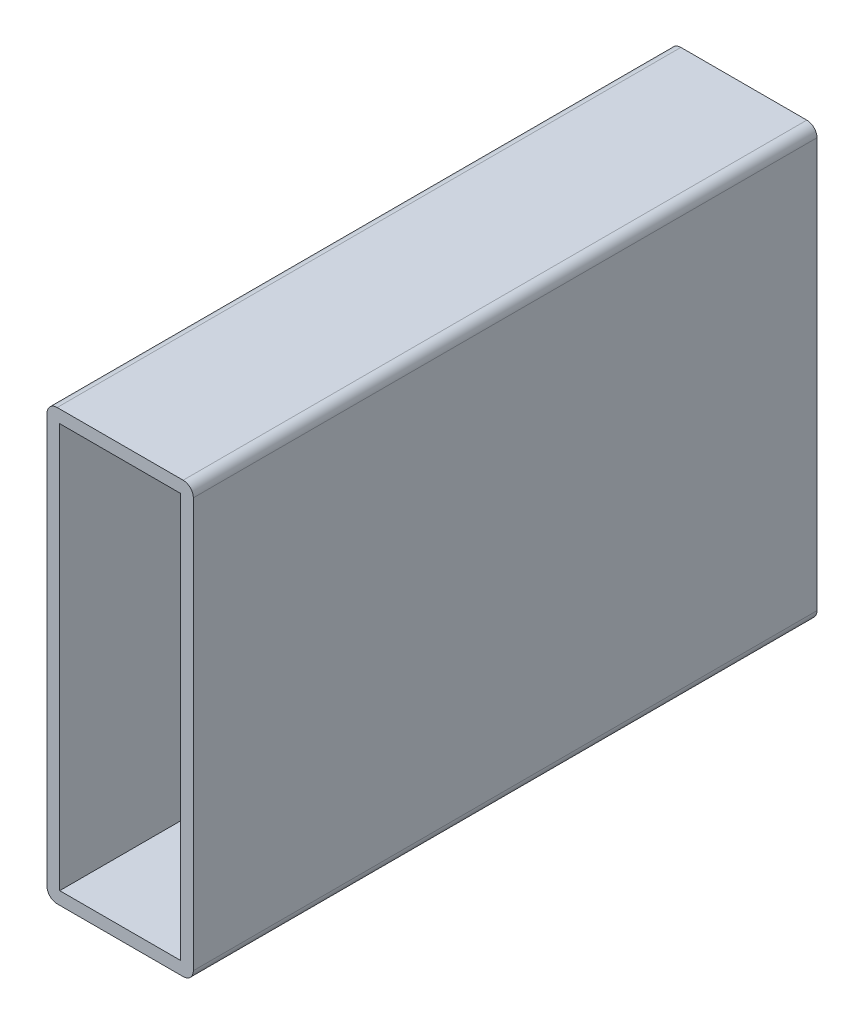
from build123d import *

# Parameters (mm, degrees)
SKETCH1_W           = 155.575
SKETCH1_H           = 107.237500028
BOSS_EXTRUDE1_DEPTH = 36.5
SHELL2_T            = -3.175
FILLET1_R           = 2.54
CUT_EXTRUDE2_REACH  = 194.447
SKETCH7_R           = 1.2
SKETCH7_W           = 15
SKETCH7_H           = 15
SKETCH8_R           = 2.38125
CUT_EXTRUDE3_DEPTH  = 190.889155594


with BuildPart() as part:
    # Sketch1 → Boss-Extrude1 (new body)
    with BuildSketch(Plane(origin=(0, 0, 0), x_dir=(0, 0, -1), z_dir=(1, 0, 0))):
        with Locations((77.7875, 53.618750014)):
            Rectangle(SKETCH1_W, SKETCH1_H)
    extrude(amount=BOSS_EXTRUDE1_DEPTH)

    # Shell2
    shell2_openings = [part.faces().sort_by_distance(p)[0] for p in [
        (18.25, 53.618750014, 0),
    ]]
    offset(amount=SHELL2_T, openings=shell2_openings, kind=Kind.INTERSECTION)

    # Fillet1
    fillet1_edges = [part.edges().sort_by_distance(p)[0] for p in [
        (36.5, 107.237500028, -77.7875),
        (0, 107.237500028, -77.7875),
        (0, 0, -77.7875),
        (36.5, 0, -77.7875),
    ]]
    fillet(fillet1_edges, radius=FILLET1_R)

    # Sketch7 → Cut-Extrude2 (cut, up to next)
    with BuildSketch(Plane(origin=(0, 0, -155.575), x_dir=(-1, 0, 0), z_dir=(0, 0, -1)), mode=Mode.PRIVATE) as cut_extrude2_sk1:
        with Locations((-7.175, 30)):
            Circle(SKETCH7_R)
    cut_extrude2_tool1 = extrude(cut_extrude2_sk1.sketch, amount=-CUT_EXTRUDE2_REACH, mode=Mode.PRIVATE) & part.part
    # Sketch7 → Cut-Extrude2 (cut, up to next)
    with BuildSketch(Plane(origin=(0, 0, -155.575), x_dir=(-1, 0, 0), z_dir=(0, 0, -1)), mode=Mode.PRIVATE) as cut_extrude2_sk2:
        with Locations((-7.175, 5)):
            Circle(SKETCH7_R)
    cut_extrude2_tool2 = extrude(cut_extrude2_sk2.sketch, amount=-CUT_EXTRUDE2_REACH, mode=Mode.PRIVATE) & part.part
    # Sketch7 → Cut-Extrude2 (cut, up to next)
    with BuildSketch(Plane(origin=(0, 0, -155.575), x_dir=(-1, 0, 0), z_dir=(0, 0, -1)), mode=Mode.PRIVATE) as cut_extrude2_sk3:
        with Locations((-20.675, 27.5)):
            Rectangle(SKETCH7_W, SKETCH7_H)
    cut_extrude2_tool3 = extrude(cut_extrude2_sk3.sketch, amount=-CUT_EXTRUDE2_REACH, mode=Mode.PRIVATE) & part.part
    add(cut_extrude2_tool1.solids().sort_by_distance((7.175, 30, -155.575))[0], mode=Mode.SUBTRACT)
    add(cut_extrude2_tool2.solids().sort_by_distance((7.175, 5, -155.575))[0], mode=Mode.SUBTRACT)
    add(cut_extrude2_tool3.solids().sort_by_distance((20.675, 27.5, -155.575))[0], mode=Mode.SUBTRACT)

    # Sketch8 → Cut-Extrude3 (cut, through all)
    with BuildSketch(Plane.XY.offset(-152.4)):
        with Locations((7.175, 25.4)):
            Circle(SKETCH8_R)
    extrude(amount=-CUT_EXTRUDE3_DEPTH, mode=Mode.SUBTRACT)


solid = part.part
